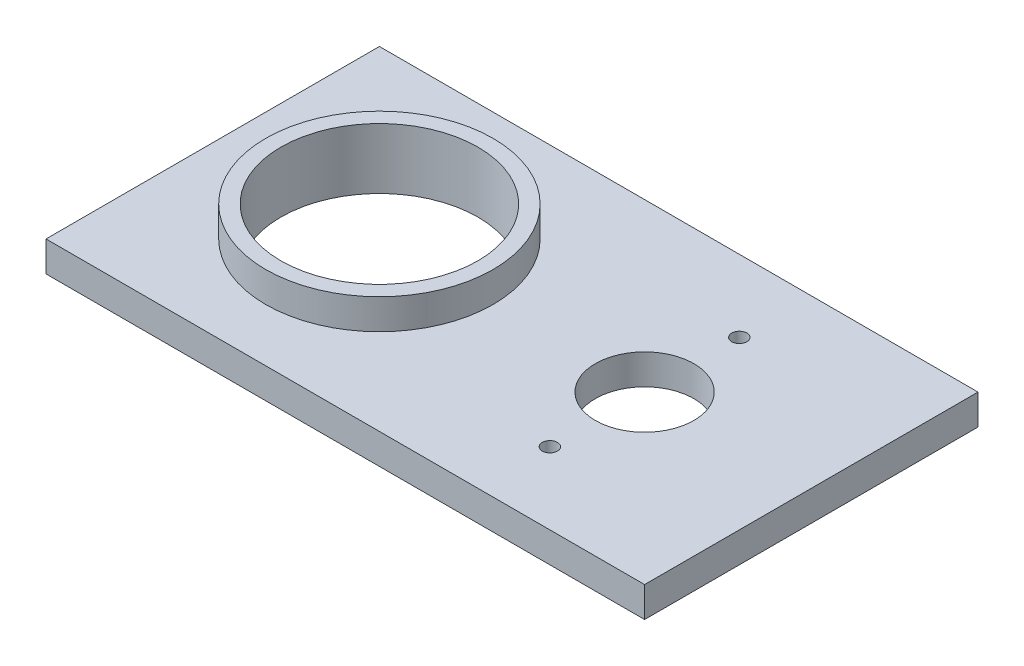
from build123d import *

# Parameters (mm, degrees)
IZIM2_W                     = 79
IZIM2_H                     = 44
IZIM2_R                     = 6.5
IZIM2_R_2                   = 1
IZIM2_R_3                   = 13
Y_KSEKLIK_EKSTR_ZYON1_DEPTH = 4
IZIM3_R                     = 15
IZIM3_R_2                   = 13
Y_KSEKLIK_EKSTR_ZYON2_DEPTH = 4


with BuildPart() as part:
    # Çizim2 → Yükseklik-Ekstrüzyon1 (new body)
    with BuildSketch(Plane(origin=(0, 0, 0), x_dir=(1, 0, 0), z_dir=(0, 1, 0))):
        with Locations((-17.5, 0)):
            Rectangle(IZIM2_W, IZIM2_H)
        with Locations(Location((0, 0, 0), (0, 0, 270))):
            Circle(IZIM2_R, mode=Mode.SUBTRACT)
        with Locations(Location((0, 12.5, 0), (0, 0, 270))):
            Circle(IZIM2_R_2, mode=Mode.SUBTRACT)
        with Locations(Location((0, -12.5, 0), (0, 0, 270))):
            Circle(IZIM2_R_2, mode=Mode.SUBTRACT)
        with Locations(Location((-35, 0, 0), (0, 0, 270))):
            Circle(IZIM2_R_3, mode=Mode.SUBTRACT)
    extrude(amount=Y_KSEKLIK_EKSTR_ZYON1_DEPTH)

    # Çizim3 → Yükseklik-Ekstrüzyon2 (add)
    with BuildSketch(Plane(origin=(0, 4, 0), x_dir=(1, 0, 0), z_dir=(0, 1, 0))):
        with Locations(Location((-35, 0, 0), (0, 0, 90))):
            Circle(IZIM3_R)
        with Locations(Location((-35, 0, 0), (0, 0, 270))):
            Circle(IZIM3_R_2, mode=Mode.SUBTRACT)
    extrude(amount=Y_KSEKLIK_EKSTR_ZYON2_DEPTH)


solid = part.part
